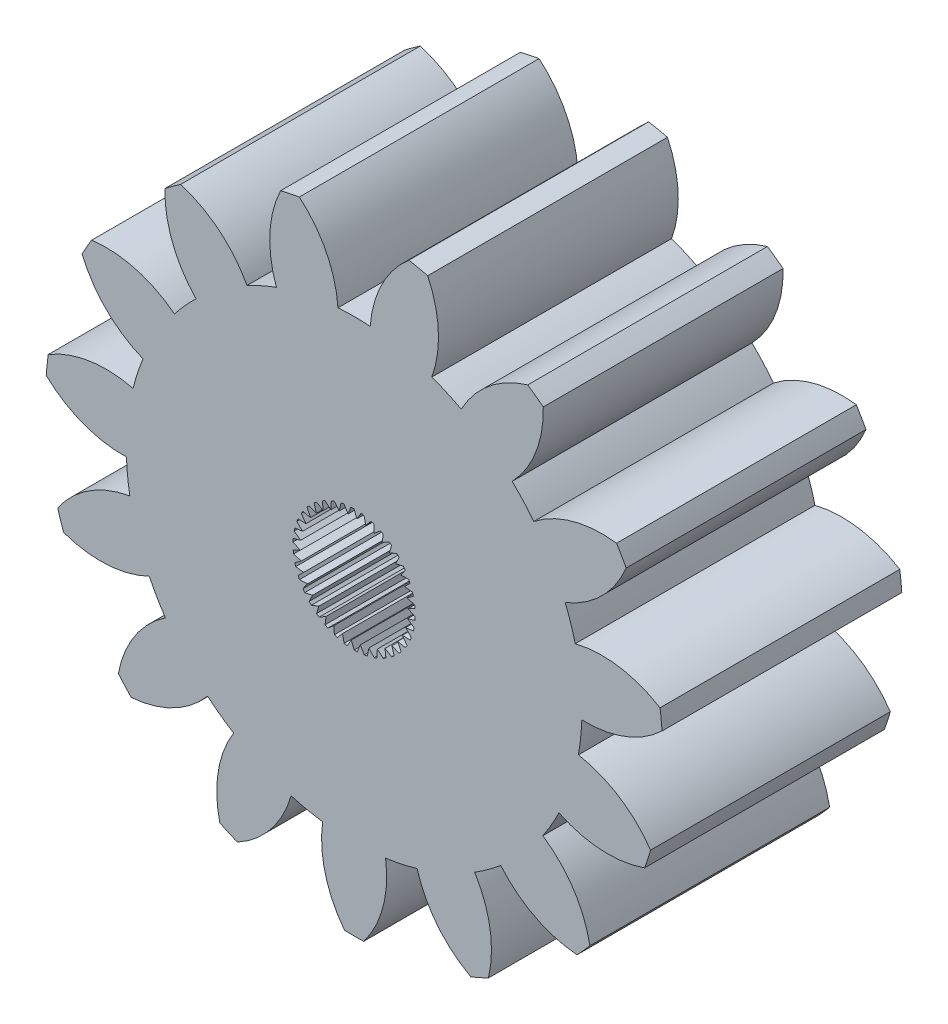
from build123d import *

# Parameters (mm, degrees)
SKETCH1_R           = 70.548036847
BOSS_EXTRUDE1_DEPTH = 10
SKETCH3_R           = 367.512428381
SKETCH3_R_2         = 2.25
CUT_EXTRUDE2_DEPTH  = 269.283414963
CUT_EXTRUDE4_DEPTH  = 10


with BuildPart() as part:
    # Sketch1 → Boss-Extrude1 (new body)
    with BuildSketch(Plane.XY):
        Circle(SKETCH1_R)
    extrude(amount=BOSS_EXTRUDE1_DEPTH)

    # Sketch3 → Cut-Extrude2 (cut, through all)
    # profile 1 of 2: a face of its own
    with BuildSketch(Plane(origin=(55.025604462, -141.718387499, 105.594585314), x_dir=(1, 0, 0), z_dir=(0, 0, 1))):
        with Locations((-43.46157653, 148.105383059)):
            Circle(SKETCH3_R)
        with BuildLine():
            ThreePointArc((-36.221197709, 158.75404699), (-37.83485513, 157.900828095), (-38.992966759, 156.489924055))
            ThreePointArc((-38.992966759, 156.489924055), (-39.597171684, 156.784978452), (-40.22073184, 157.036560288))
            ThreePointArc((-40.22073184, 157.036560288), (-39.94715374, 158.841284028), (-40.392836102, 160.611380068))
            ThreePointArc((-40.392836102, 160.611380068), (-40.784297687, 160.700989713), (-41.178363167, 160.778349))
            ThreePointArc((-41.178363167, 160.778349), (-42.305477185, 159.342561151), (-42.78959843, 157.582589738))
            ThreePointArc((-42.78959843, 157.582589738), (-43.46157653, 157.606383059), (-44.13355463, 157.582589738))
            ThreePointArc((-44.13355463, 157.582589738), (-44.617675875, 159.342561151), (-45.744789893, 160.778349))
            ThreePointArc((-45.744789893, 160.778349), (-46.138855373, 160.700989713), (-46.530316958, 160.611380068))
            ThreePointArc((-46.530316958, 160.611380068), (-46.97599932, 158.841284028), (-46.70242122, 157.036560288))
            ThreePointArc((-46.70242122, 157.036560288), (-47.325981376, 156.784978452), (-47.930186301, 156.489924055))
            ThreePointArc((-47.930186301, 156.489924055), (-49.08829793, 157.900828095), (-50.701955351, 158.75404699))
            ThreePointArc((-50.701955351, 158.75404699), (-51.030487224, 158.523094895), (-51.35165765, 158.282010639))
            ThreePointArc((-51.35165765, 158.282010639), (-51.038845827, 156.483672095), (-50.05487252, 154.946249158))
            ThreePointArc((-50.05487252, 154.946249158), (-50.522195517, 154.46279295), (-50.954154747, 153.947495063))
            ThreePointArc((-50.954154747, 153.947495063), (-52.586008738, 154.765373604), (-54.407193535, 154.888494247))
            ThreePointArc((-54.407193535, 154.888494247), (-54.613385655, 154.543883059), (-54.808731638, 154.193009851))
            ThreePointArc((-54.808731638, 154.193009851), (-53.791513635, 152.677377874), (-52.267283046, 151.673090132))
            ThreePointArc((-52.267283046, 151.673090132), (-52.497564491, 151.041353522), (-52.682588351, 150.394911831))
            ThreePointArc((-52.682588351, 150.394911831), (-54.506022324, 150.478346243), (-56.2198351, 149.850079957))
            ThreePointArc((-56.2198351, 149.850079957), (-56.268034977, 149.45139608), (-56.303779422, 149.051403085))
            ThreePointArc((-56.303779422, 149.051403085), (-54.758041473, 148.080544213), (-52.957106917, 147.783042142))
            ThreePointArc((-52.957106917, 147.783042142), (-52.910529058, 147.112258129), (-52.816625241, 146.446448275))
            ThreePointArc((-52.816625241, 146.446448275), (-54.516350897, 145.78101199), (-55.826457853, 144.509991723))
            ThreePointArc((-55.826457853, 144.509991723), (-55.70833129, 144.126171222), (-55.578293658, 143.746220863))
            ThreePointArc((-55.578293658, 143.746220863), (-53.771307897, 143.488005415), (-52.005067321, 143.948729824))
            ThreePointArc((-52.005067321, 143.948729824), (-51.689683891, 143.354883059), (-51.333089221, 142.784829614))
            ThreePointArc((-51.333089221, 142.784829614), (-52.615208552, 141.485582611), (-53.295080295, 139.791579314))
            ThreePointArc((-53.295080295, 139.791579314), (-53.031052448, 139.488988241), (-52.757717425, 139.194777386))
            ThreePointArc((-52.757717425, 139.194777386), (-51.001928107, 139.693853158), (-49.575780551, 140.833140613))
            ThreePointArc((-49.575780551, 140.833140613), (-49.046124212, 140.418912595), (-48.488497146, 140.04318298))
            ThreePointArc((-48.488497146, 140.04318298), (-49.131320073, 138.334776868), (-49.0634006, 136.510699101))
            ThreePointArc((-49.0634006, 136.510699101), (-48.699124283, 136.341658201), (-48.32975398, 136.18405858))
            ThreePointArc((-48.32975398, 136.18405858), (-46.928753028, 137.354130838), (-46.089292361, 138.974988187))
            ThreePointArc((-46.089292361, 138.974988187), (-45.436945504, 138.812002704), (-44.774704829, 138.695563981))
            ThreePointArc((-44.774704829, 138.695563981), (-44.667081427, 136.873397699), (-43.863114633, 135.234645079))
            ThreePointArc((-43.863114633, 135.234645079), (-43.46157653, 135.228383059), (-43.060038427, 135.234645079))
            ThreePointArc((-43.060038427, 135.234645079), (-42.256071633, 136.873397699), (-42.148448231, 138.695563981))
            ThreePointArc((-42.148448231, 138.695563981), (-41.486207556, 138.812002704), (-40.833860699, 138.974988187))
            ThreePointArc((-40.833860699, 138.974988187), (-39.994400032, 137.354130838), (-38.59339908, 136.18405858))
            ThreePointArc((-38.59339908, 136.18405858), (-38.224028777, 136.341658201), (-37.85975246, 136.510699101))
            ThreePointArc((-37.85975246, 136.510699101), (-37.791832987, 138.334776868), (-38.434655914, 140.04318298))
            ThreePointArc((-38.434655914, 140.04318298), (-37.877028848, 140.418912595), (-37.347372509, 140.833140613))
            ThreePointArc((-37.347372509, 140.833140613), (-35.921224953, 139.693853158), (-34.165435635, 139.194777386))
            ThreePointArc((-34.165435635, 139.194777386), (-33.892100612, 139.488988241), (-33.628072766, 139.791579314))
            ThreePointArc((-33.628072766, 139.791579314), (-34.307944508, 141.485582611), (-35.590063839, 142.784829614))
            ThreePointArc((-35.590063839, 142.784829614), (-35.233469169, 143.354883059), (-34.918085739, 143.948729824))
            ThreePointArc((-34.918085739, 143.948729824), (-33.151845163, 143.488005415), (-31.344859402, 143.746220863))
            ThreePointArc((-31.344859402, 143.746220863), (-31.21482177, 144.126171222), (-31.096695207, 144.509991723))
            ThreePointArc((-31.096695207, 144.509991723), (-32.406802163, 145.78101199), (-34.106527819, 146.446448275))
            ThreePointArc((-34.106527819, 146.446448275), (-34.012624002, 147.112258129), (-33.966046143, 147.783042142))
            ThreePointArc((-33.966046143, 147.783042142), (-32.165111587, 148.080544213), (-30.619373638, 149.051403085))
            ThreePointArc((-30.619373638, 149.051403085), (-30.655118083, 149.45139608), (-30.70331796, 149.850079957))
            ThreePointArc((-30.70331796, 149.850079957), (-32.417130736, 150.478346243), (-34.240564709, 150.394911831))
            ThreePointArc((-34.240564709, 150.394911831), (-34.425588569, 151.041353522), (-34.655870014, 151.673090132))
            ThreePointArc((-34.655870014, 151.673090132), (-33.131639425, 152.677377874), (-32.114421422, 154.193009851))
            ThreePointArc((-32.114421422, 154.193009851), (-32.309767405, 154.543883059), (-32.515959526, 154.888494247))
            ThreePointArc((-32.515959526, 154.888494247), (-34.337144322, 154.765373604), (-35.968998313, 153.947495063))
            ThreePointArc((-35.968998313, 153.947495063), (-36.400957543, 154.46279295), (-36.86828054, 154.946249158))
            ThreePointArc((-36.86828054, 154.946249158), (-35.884307233, 156.483672095), (-35.57149541, 158.282010639))
            ThreePointArc((-35.57149541, 158.282010639), (-35.892665836, 158.523094895), (-36.221197709, 158.75404699))
        make_face(mode=Mode.SUBTRACT)
    # profile 2 of 2: a face of its own
    with BuildSketch(Plane(origin=(55.025604462, -141.718387499, 105.594585314), x_dir=(1, 0, 0), z_dir=(0, 0, 1))):
        with Locations((-43.46157653, 148.105383059)):
            Circle(SKETCH3_R_2)
    extrude(amount=-CUT_EXTRUDE2_DEPTH, mode=Mode.SUBTRACT)

    # Sketch4 → Cut-Extrude4 (cut)
    with BuildSketch(Plane.XY.offset(10)):
        with BuildLine():
            ThreePointArc((9.619262983, 5.255452678), (9.53246327, 5.419914887), (9.459541205, 5.590983238))
            Line((9.459541205, 5.590983238), (9.229545603, 5.360987636))
            ThreePointArc((9.229545603, 5.360987636), (9.256631549, 5.301444117), (9.285235916, 5.242614963))
            Line((9.285235916, 5.242614963), (9.619262983, 5.255452678))
        make_face()
        with BuildLine():
            Line((9.127956814, 5.633299661), (9.459541205, 5.590983238))
            ThreePointArc((9.459541205, 5.590983238), (9.400994917, 5.76748916), (9.357224339, 5.948226939))
            Line((9.357224339, 5.948226939), (9.092509546, 5.759224209))
            ThreePointArc((9.092509546, 5.759224209), (9.109425534, 5.696034586), (9.127956814, 5.633299661))
        make_face()
        with BuildLine():
            Line((9.037127381, 6.044543218), (9.357224339, 5.948226939))
            ThreePointArc((9.357224339, 5.948226939), (9.328528466, 6.131961952), (9.315103322, 6.317439104))
            Line((9.315103322, 6.317439104), (9.022890067, 6.174584748))
            ThreePointArc((9.022890067, 6.174584748), (9.029174673, 6.109472669), (9.037127381, 6.044543218))
        make_face()
        with BuildLine():
            ThreePointArc((9.832032879, 4.950787658), (9.719347412, 5.098720054), (9.619262983, 5.255452678))
            Line((9.619262983, 5.255452678), (9.430260253, 4.990737885))
            ThreePointArc((9.430260253, 4.990737885), (9.466777323, 4.936464661), (9.504674525, 4.883145984))
            Line((9.504674525, 4.883145984), (9.832032879, 4.950787658))
        make_face()
        with BuildLine():
            Line((9.015225208, 6.465127982), (9.315103322, 6.317439104))
            ThreePointArc((9.315103322, 6.317439104), (9.317040613, 6.503391397), (9.334327106, 6.688548588))
            Line((9.334327106, 6.688548588), (9.022586205, 6.595739301))
            ThreePointArc((9.022586205, 6.595739301), (9.018068001, 6.530480853), (9.015225208, 6.465127982))
        make_face()
        with BuildLine():
            ThreePointArc((10.092047085, 4.685298645), (9.956549629, 4.812666018), (9.832032879, 4.950787658))
            Line((9.832032879, 4.950787658), (9.689178523, 4.658574403))
            ThreePointArc((9.689178523, 4.658574403), (9.734130627, 4.611051908), (9.780286925, 4.564698102))
            Line((9.780286926, 4.564698102), (10.092047085, 4.685298645))
        make_face()
        with BuildLine():
            Line((9.062847729, 6.883581498), (9.334327106, 6.688548588))
            ThreePointArc((9.334327106, 6.688548588), (9.366844717, 6.871645866), (9.414371316, 7.051432492))
            Line((9.414371316, 7.051432492), (9.091606248, 7.011199868))
            ThreePointArc((9.091606248, 7.011199868), (9.076408479, 6.947575132), (9.062847729, 6.883581498))
        make_face()
        with BuildLine():
            ThreePointArc((10.392213092, 4.466227489), (10.237599663, 4.569555588), (10.092047085, 4.685298645))
            Line((10.092047085, 4.685298645), (9.999237798, 4.373557744))
            ThreePointArc((9.999237798, 4.373557744), (10.051398759, 4.334082267), (10.104555131, 4.295957744))
            Line((10.104555131, 4.295957744), (10.392213092, 4.466227489))
        make_face()
        with BuildLine():
            Line((9.178695926, 7.288489444), (9.414371316, 7.051432492))
            ThreePointArc((9.414371316, 7.051432492), (9.476582251, 7.226680339), (9.553052555, 7.396192288))
            Line((9.553052555, 7.396192288), (9.228067509, 7.409633769))
            ThreePointArc((9.22806751, 7.409633769), (9.202604731, 7.349378262), (9.178695926, 7.288489444))
        make_face()
        with BuildLine():
            ThreePointArc((10.724343152, 4.299549878), (10.554831203, 4.376020183), (10.392213092, 4.466227489))
            Line((10.392213092, 4.466227489), (10.351980468, 4.143462421))
            ThreePointArc((10.351980468, 4.143462421), (10.409927472, 4.11311075), (10.46863395, 4.084255447))
            Line((10.468633951, 4.084255447), (10.724343152, 4.299549879))
        make_face()
        with BuildLine():
            Line((9.359609762, 7.668806986), (9.553052555, 7.396192288))
            ThreePointArc((9.553052555, 7.396192288), (9.643259861, 7.558810399), (9.74658796, 7.713423828))
            Line((9.74658796, 7.713423828), (9.428247682, 7.780172765))
            ThreePointArc((9.428247682, 7.780172765), (9.393214452, 7.724930101), (9.359609762, 7.668806986))
        make_face()
        with BuildLine():
            ThreePointArc((11.079377625, 4.189812345), (10.899591, 4.237338944), (10.724343152, 4.299549878))
            Line((10.724343152, 4.299549879), (10.737784633, 3.974564833))
            ThreePointArc((10.737784633, 3.974564833), (10.799937036, 3.954164882), (10.862592262, 3.935365897))
            Line((10.862592262, 3.935365897), (11.079377625, 4.189812345))
        make_face()
        with BuildLine():
            Line((9.600654379, 8.014160054), (9.74658796, 7.713423828))
            ThreePointArc((9.74658796, 7.713423828), (9.862331018, 7.858976406), (9.98969839, 7.994473862))
            Line((9.98969839, 7.994473863), (9.686686372, 8.112709519))
            ThreePointArc((9.686686372, 8.112709519), (9.643038306, 8.063986573), (9.600654379, 8.014160054))
        make_face()
        with BuildLine():
            ThreePointArc((11.447632094, 4.140008241), (11.262474903, 4.157294734), (11.079377625, 4.189812345))
            Line((11.079377625, 4.189812345), (11.146126562, 3.871472066))
            ThreePointArc((11.146126562, 3.871472066), (11.210789009, 3.861580294), (11.27568391, 3.853350414))
            Line((11.27568391, 3.853350414), (11.447632094, 4.140008241))
        make_face()
        with BuildLine():
            Line((9.895254709, 8.315128317), (9.98969839, 7.994473863))
            ThreePointArc((9.98969839, 7.994473862), (10.12782003, 8.118990612), (10.275752426, 8.231676079))
            Line((10.275752426, 8.23167608), (9.996334046, 8.398173295))
            ThreePointArc((9.996334046, 8.398173294), (9.945261749, 8.357299101), (9.895254709, 8.315128317))
        make_face()
        with BuildLine():
            ThreePointArc((11.819061539, 4.151496094), (11.633584387, 4.13807095), (11.447632094, 4.140008241))
            Line((11.447632094, 4.140008241), (11.565867751, 3.836996223))
            ThreePointArc((11.565867751, 3.836996223), (11.631276418, 3.837882451), (11.696640831, 3.840446165))
            Line((11.696640831, 3.840446165), (11.819061539, 4.151496094))
        make_face()
        with BuildLine():
            Line((10.235374821, 8.563502144), (10.275752426, 8.23167608))
            ThreePointArc((10.275752426, 8.231676079), (10.43248505, 8.331760508), (10.596947259, 8.418560221))
            Line((10.596947259, 8.418560221), (10.348744323, 8.628777384))
            ThreePointArc((10.348744323, 8.628777384), (10.291640914, 8.596866886), (10.235374822, 8.563502144))
        make_face()
        with BuildLine():
            ThreePointArc((12.183534332, 4.223962545), (12.002796553, 4.180191967), (11.819061539, 4.151496094))
            Line((11.819061539, 4.151496094), (11.985558754, 3.872077715))
            ThreePointArc((11.985558754, 3.872077715), (12.049929464, 3.883717768), (12.113980419, 3.897005145))
            Line((12.113980419, 3.897005146), (12.183534331, 4.223962545))
        make_face()
        with BuildLine():
            Line((10.611737128, 8.752506546), (10.596947259, 8.418560221))
            ThreePointArc((10.596947259, 8.418560221), (10.76801561, 8.491482286), (10.944521532, 8.550028574))
            Line((10.944521532, 8.550028574), (10.734304368, 8.79823151))
            ThreePointArc((10.734304368, 8.79823151), (10.67272748, 8.776155141), (10.611737128, 8.752506545))
        make_face()
        with BuildLine():
            ThreePointArc((12.531108604, 4.355430898), (12.360040254, 4.282508833), (12.183534332, 4.223962545))
            Line((12.183534331, 4.223962545), (12.393751495, 3.975759609))
            ThreePointArc((12.393751495, 3.975759609), (12.455328383, 3.997835978), (12.516318736, 4.021484574))
            Line((12.516318735, 4.021484574), (12.531108604, 4.355430899))
        make_face()
        with BuildLine():
            Line((11.014075445, 8.876985974), (10.944521532, 8.550028574))
            ThreePointArc((10.944521532, 8.550028574), (11.125259311, 8.593799152), (11.308994324, 8.622495025))
            Line((11.308994324, 8.622495025), (11.142497109, 8.901913404))
            ThreePointArc((11.142497109, 8.901913404), (11.078126399, 8.890273351), (11.014075445, 8.876985973))
        make_face()
        with BuildLine():
            ThreePointArc((12.852303438, 4.54231504), (12.695570814, 4.442230611), (12.531108604, 4.355430898))
            Line((12.531108604, 4.355430899), (12.77931154, 4.145213735))
            ThreePointArc((12.779311541, 4.145213735), (12.836414949, 4.177124233), (12.892681042, 4.210488975))
            Line((12.892681042, 4.210488975), (12.852303438, 4.54231504))
        make_face()
        with BuildLine():
            Line((11.431415032, 8.933544954), (11.308994324, 8.622495025))
            ThreePointArc((11.308994324, 8.622495025), (11.494471476, 8.635920169), (11.680423769, 8.633982878))
            Line((11.680423769, 8.633982878), (11.562188112, 8.936994896))
            ThreePointArc((11.562188112, 8.936994896), (11.496779445, 8.936108668), (11.431415032, 8.933544954))
        make_face()
        with BuildLine():
            ThreePointArc((13.138357473, 4.779517257), (13.000235834, 4.655000507), (12.852303438, 4.54231504))
            Line((12.852303438, 4.54231504), (13.131721817, 4.375817825))
            ThreePointArc((13.131721817, 4.375817825), (13.182794114, 4.416692018), (13.232801155, 4.458862802))
            Line((13.232801155, 4.458862802), (13.138357473, 4.779517257))
        make_face()
        with BuildLine():
            Line((11.852371953, 8.920640705), (11.680423769, 8.633982878))
            ThreePointArc((11.680423769, 8.633982878), (11.86558096, 8.616696385), (12.048678238, 8.584178774))
            Line((12.048678238, 8.584178775), (11.981929301, 8.902519053))
            ThreePointArc((11.981929301, 8.902519053), (11.917266854, 8.912410825), (11.852371953, 8.920640705))
        make_face()
        with BuildLine():
            ThreePointArc((13.381467903, 5.060567291), (13.265724846, 4.915014713), (13.138357473, 4.779517257))
            Line((13.138357473, 4.779517257), (13.441369491, 4.6612816))
            ThreePointArc((13.441369491, 4.6612816), (13.485017557, 4.710004547), (13.527401484, 4.759831065))
            Line((13.527401484, 4.759831065), (13.381467903, 5.060567291))
        make_face()
        with BuildLine():
            Line((12.265463601, 8.838625222), (12.048678238, 8.584178775))
            ThreePointArc((12.048678238, 8.584178774), (12.228464863, 8.536652175), (12.403712711, 8.474441241))
            Line((12.403712711, 8.474441241), (12.39027123, 8.799426286))
            ThreePointArc((12.39027123, 8.799426286), (12.328118827, 8.819826237), (12.265463601, 8.838625222))
        make_face()
        with BuildLine():
            ThreePointArc((13.575003308, 5.377798832), (13.484796002, 5.21518072), (13.381467903, 5.060567291))
            Line((13.381467903, 5.060567291), (13.699808181, 4.993818354))
            ThreePointArc((13.699808181, 4.993818354), (13.734841411, 5.049061019), (13.768446101, 5.105184133))
            Line((13.768446101, 5.105184133), (13.575003308, 5.377798832))
        make_face()
        with BuildLine():
            Line((12.659421913, 8.689735672), (12.403712711, 8.474441241))
            ThreePointArc((12.403712711, 8.474441241), (12.57322466, 8.397970936), (12.735842771, 8.30776363))
            Line((12.735842771, 8.30776363), (12.776075395, 8.630528699))
            ThreePointArc((12.776075395, 8.630528698), (12.718128391, 8.660880369), (12.659421912, 8.689735672))
        make_face()
        with BuildLine():
            ThreePointArc((13.713684547, 5.722558628), (13.651473613, 5.54731078), (13.575003308, 5.377798832))
            Line((13.575003308, 5.377798832), (13.899988354, 5.364357351))
            ThreePointArc((13.899988354, 5.364357351), (13.925451133, 5.424612857), (13.949359937, 5.485501676))
            Line((13.949359937, 5.485501676), (13.713684547, 5.722558628))
        make_face()
        with BuildLine():
            Line((13.023500732, 8.478033375), (12.735842771, 8.30776363))
            ThreePointArc((12.735842771, 8.30776363), (12.8904562, 8.204435531), (13.036008778, 8.088692474))
            Line((13.036008778, 8.088692474), (13.128818065, 8.400433375))
            ThreePointArc((13.128818065, 8.400433375), (13.076657104, 8.439908852), (13.023500732, 8.478033375))
        make_face()
        with BuildLine():
            ThreePointArc((13.793728757, 6.085442531), (13.761211147, 5.902345253), (13.713684547, 5.722558628))
            Line((13.713684547, 5.722558628), (14.036449615, 5.762791251))
            ThreePointArc((14.036449615, 5.762791251), (14.051647385, 5.826415987), (14.065208134, 5.890409621))
            Line((14.065208134, 5.890409621), (13.793728757, 6.085442531))
        make_face()
        with BuildLine():
            Line((13.347768938, 8.209293017), (13.036008778, 8.088692474))
            ThreePointArc((13.036008778, 8.088692474), (13.171506234, 7.961325101), (13.296022984, 7.823203461))
            Line((13.296022984, 7.823203462), (13.43887734, 8.115416717))
            ThreePointArc((13.43887734, 8.115416717), (13.393925236, 8.162939212), (13.347768937, 8.209293017))
        make_face()
        with BuildLine():
            ThreePointArc((13.812952541, 6.456552015), (13.81101525, 6.270599722), (13.793728757, 6.085442531))
            Line((13.793728757, 6.085442531), (14.105469658, 6.178251819))
            ThreePointArc((14.105469658, 6.178251819), (14.109987863, 6.243510266), (14.112830655, 6.308863137))
            Line((14.112830655, 6.308863137), (13.812952541, 6.456552015))
        make_face()
        with BuildLine():
            Line((13.623381338, 7.890845135), (13.296022984, 7.823203462))
            ThreePointArc((13.296022984, 7.823203461), (13.408708451, 7.675271066), (13.50879288, 7.518538442))
            Line((13.50879288, 7.518538442), (13.69779561, 7.783253235))
            ThreePointArc((13.69779561, 7.783253235), (13.66127854, 7.837526458), (13.623381338, 7.890845135))
        make_face()
        with BuildLine():
            Line((13.842819947, 7.531376157), (13.50879288, 7.518538442))
            ThreePointArc((13.50879288, 7.518538442), (13.595592593, 7.354076232), (13.668514658, 7.183007882))
            Line((13.668514658, 7.183007882), (13.89851026, 7.413003483))
            ThreePointArc((13.89851026, 7.413003483), (13.871424314, 7.472547003), (13.842819947, 7.531376157))
        make_face()
        with BuildLine():
            ThreePointArc((13.770831524, 6.825764181), (13.799527397, 6.642029167), (13.812952541, 6.456552015))
            Line((13.812952541, 6.456552015), (14.105165796, 6.599406371))
            ThreePointArc((14.105165796, 6.599406371), (14.098881191, 6.664518451), (14.090928482, 6.729447901))
            Line((14.090928482, 6.729447901), (13.770831524, 6.825764181))
        make_face()
        with BuildLine():
            Line((14.000099049, 7.140691459), (13.668514658, 7.183007882))
            ThreePointArc((13.668514658, 7.183007882), (13.727060946, 7.00650196), (13.770831524, 6.825764181))
            Line((13.770831524, 6.825764181), (14.035546317, 7.01476691))
            ThreePointArc((14.035546317, 7.01476691), (14.01863033, 7.077956534), (14.000099049, 7.140691459))
        make_face()
    extrude(amount=-CUT_EXTRUDE4_DEPTH, mode=Mode.SUBTRACT)


solid = part.part
